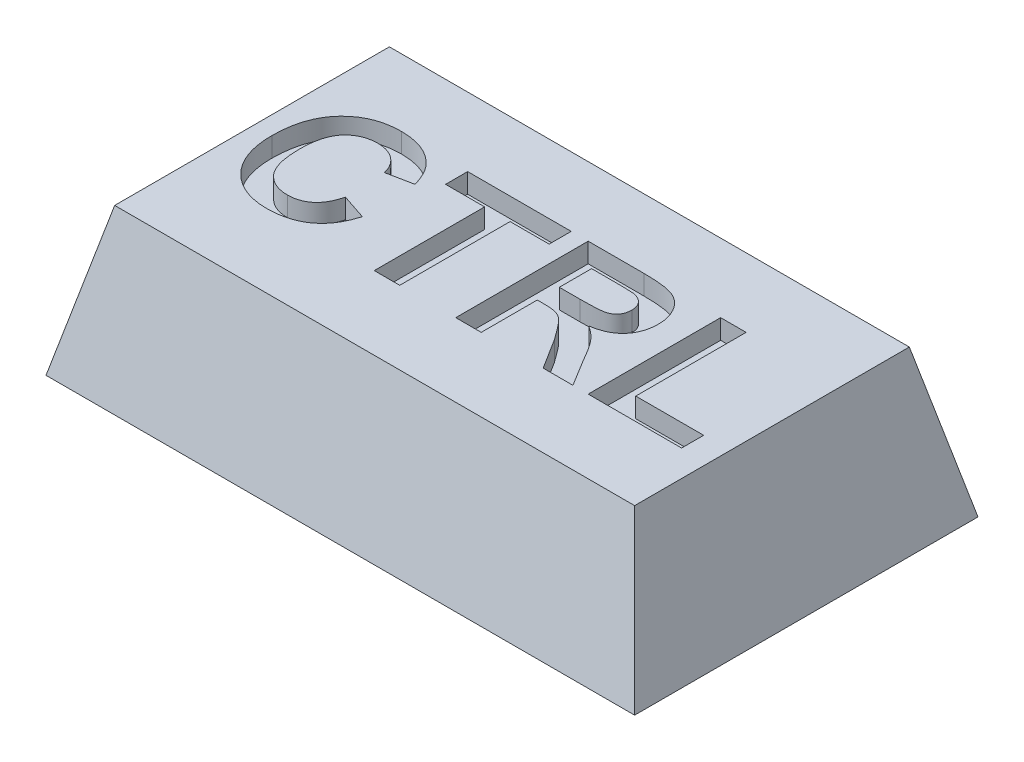
from build123d import *

# Parameters (mm, degrees)
SKETCH1_W               = 12
SKETCH1_H               = 7
BOSS_EXTRUDE1_DEPTH     = 3
CUT_EXTRUDE1_DEPTH      = 7
CUT_EXTRUDE2_DEPTH      = 15.212670404
CUT_EXTRUDE2_DEPTH_BACK = 15.212670404
SKETCH4_R               = 1.8
CUT_EXTRUDE3_DEPTH      = 0.8
CUT_EXTRUDE4_DEPTH      = 0.4


with BuildPart() as part:
    # Sketch1 → Boss-Extrude1 (new body)
    with BuildSketch(Plane(origin=(0, 0, 0), x_dir=(1, 0, 0), z_dir=(0, 1, 0))):
        with Locations((6, 3.5)):
            Rectangle(SKETCH1_W, SKETCH1_H)
    extrude(amount=BOSS_EXTRUDE1_DEPTH)

    # Sketch2 → Cut-Extrude1 (cut)
    with BuildSketch(Plane.XY):
        Polygon((0, 0), (0.7, 3), (0, 3), align=None)
        Polygon((12, 0), (11.3, 3), (12, 3), align=None)
    extrude(amount=-CUT_EXTRUDE1_DEPTH, mode=Mode.SUBTRACT)

    # Sketch3 → Cut-Extrude2 (cut, two sides: drawn at the far end of the back side and taken through both)
    with BuildSketch(Plane(origin=(0, 0, 0), x_dir=(0, 0, -1), z_dir=(1, 0, 0)).offset(-CUT_EXTRUDE2_DEPTH_BACK)):
        Polygon((0, 0), (0.7, 3), (0, 3), align=None)
        Polygon((7, 3), (6.3, 3), (7, 0), align=None)
    extrude(amount=CUT_EXTRUDE2_DEPTH + CUT_EXTRUDE2_DEPTH_BACK, mode=Mode.SUBTRACT)

    # Sketch4 → Cut-Extrude3 (cut)
    with BuildSketch(Plane.XZ):
        with Locations(Location((6, -3.5, 0), (0, 0, 270))):
            Circle(SKETCH4_R)
    extrude(amount=-CUT_EXTRUDE3_DEPTH, mode=Mode.SUBTRACT)

    # Sketch5 → Cut-Extrude4 (cut)
    # profile 1 of 4: a face of its own
    with BuildSketch(Plane(origin=(0, 3, 0), x_dir=(1, 0, 0), z_dir=(0, 1, 0))):
        with BuildLine():
            Line((2.904301517, 3.198955738), (3.423532286, 3.025878815))
            add(Edge.make_bspline(
                [(3.423532286, 3.025878815), (3.412979919, 2.991834161), (3.392315064, 2.92516402), (3.354370926, 2.829609877), (3.310982393, 2.741055496), (3.263709812, 2.658464408), (3.209613395, 2.583970206), (3.151721747, 2.515106434), (3.088313517, 2.453323494), (3.01970158, 2.398489455), (2.946546364, 2.349998522), (2.867998092, 2.309004749), (2.785228987, 2.273697875), (2.697399724, 2.245091862), (2.605093196, 2.222182789), (2.507876294, 2.207051221), (2.406203791, 2.196791518), (2.336780345, 2.195679117), (2.301236613, 2.195109584)],
                knots=[0, 0, 0, 0, 1.126640671, 2.206316847, 3.246446654, 4.24268115, 5.210795778, 6.153057602, 7.084219323, 8.004711971, 8.926421631, 9.854560063, 10.802134612, 11.768317461, 12.772025444, 13.805668576, 14.876536225, 16, 16, 16, 16], degree=3))
            add(Edge.make_bspline(
                [(2.301236613, 2.195109584), (2.25736514, 2.196016751), (2.171068639, 2.197801176), (2.044868181, 2.215763872), (1.924604851, 2.243789961), (1.810106604, 2.282591594), (1.702137701, 2.333984258), (1.599713096, 2.395854363), (1.503578201, 2.469457973), (1.41407027, 2.553554582), (1.332750152, 2.647502206), (1.262429286, 2.750793176), (1.202342539, 2.861972376), (1.153777331, 2.981569919), (1.115802616, 3.109463), (1.089201249, 3.245474787), (1.072555805, 3.389648123), (1.070659403, 3.488451991), (1.069686132, 3.539160065)],
                knots=[0, 0, 0, 0, 1.025049111, 2.016302254, 2.973197159, 3.90886983, 4.83646737, 5.763135642, 6.70136783, 7.661478232, 8.629732022, 9.600038443, 10.576877021, 11.5787097, 12.612181225, 13.690866959, 14.814907849, 16, 16, 16, 16], degree=3))
            add(Edge.make_bspline(
                [(1.069686132, 3.539160065), (1.070655016, 3.592571755), (1.072545132, 3.696768218), (1.089221758, 3.848260954), (1.115111229, 3.991034026), (1.153150126, 4.124202184), (1.201001661, 4.24870262), (1.26116136, 4.363299428), (1.330780777, 4.469520496), (1.411731825, 4.565418922), (1.501647677, 4.650563757), (1.598003634, 4.72585481), (1.701698609, 4.789018605), (1.812165161, 4.840670652), (1.929551445, 4.880641547), (2.053626477, 4.90942373), (2.184491772, 4.92617681), (2.273965024, 4.928526069), (2.319626036, 4.929724969)],
                knots=[0, 0, 0, 0, 1.212648312, 2.365655595, 3.457000981, 4.504219827, 5.506356588, 6.480637568, 7.437950897, 8.385265166, 9.323599949, 10.245787653, 11.157260172, 12.074946661, 13.00980897, 13.968233668, 14.963125779, 16, 16, 16, 16], degree=3))
            add(Edge.make_bspline(
                [(2.319626036, 4.929724969), (2.359503563, 4.928720159), (2.437688761, 4.926750094), (2.552183044, 4.913365405), (2.660691583, 4.88987617), (2.763800902, 4.858170926), (2.860924045, 4.816328437), (2.952235009, 4.765197347), (3.038047652, 4.705048191), (3.089751535, 4.658064577), (3.115779882, 4.634412469)],
                knots=[0, 0, 0, 0, 1.098510076, 2.153775193, 3.169777012, 4.153122333, 5.120892526, 6.076995459, 7.031936742, 8, 8, 8, 8], degree=3))
            add(Edge.make_bspline(
                [(3.115779882, 4.634412469), (3.130865571, 4.619362392), (3.1613913, 4.588908724), (3.202151715, 4.537494303), (3.240797653, 4.48214667), (3.276715725, 4.421921665), (3.308770718, 4.356364167), (3.338505148, 4.286480932), (3.365880522, 4.212002582), (3.381104378, 4.160170252), (3.388916902, 4.133571123)],
                knots=[0, 0, 0, 0, 0.885292881, 1.791380647, 2.722937556, 3.69093542, 4.703306561, 5.754477758, 6.847650944, 8, 8, 8, 8], degree=3))
            Line((3.388916902, 4.133571123), (2.869686132, 4.029724969))
            add(Edge.make_bspline(
                [(2.869686132, 4.029724969), (2.865272884, 4.046755768), (2.856579944, 4.080301975), (2.838990961, 4.128506031), (2.81881501, 4.174247375), (2.793808768, 4.216405643), (2.767245672, 4.256856335), (2.735796465, 4.293803317), (2.701469605, 4.328214887), (2.664017805, 4.359733936), (2.623887546, 4.387723575), (2.581851476, 4.412884517), (2.537145573, 4.433423708), (2.490364536, 4.450039865), (2.441694689, 4.463971261), (2.390702722, 4.472577333), (2.337826596, 4.479184016), (2.301800218, 4.479542008), (2.283388056, 4.479724969)],
                knots=[0, 0, 0, 0, 1.051226935, 2.070641259, 3.064374968, 4.034983734, 4.997599858, 5.953980297, 6.92954377, 7.901109626, 8.875958313, 9.851998019, 10.826131395, 11.811470594, 12.818270757, 13.847890818, 14.900111925, 16, 16, 16, 16], degree=3))
            add(Edge.make_bspline(
                [(2.283388056, 4.479724969), (2.258102365, 4.479214313), (2.208752263, 4.478217666), (2.136619529, 4.467105725), (2.067868834, 4.451597862), (2.002777447, 4.427917435), (1.941748463, 4.397630364), (1.884088282, 4.360813044), (1.830113375, 4.31762317), (1.779805498, 4.267549086), (1.734661017, 4.209685427), (1.694972575, 4.143912725), (1.662047454, 4.069484249), (1.635317492, 3.987130374), (1.614277967, 3.896655264), (1.599254089, 3.797942878), (1.590945433, 3.690925687), (1.58960767, 3.616878354), (1.588916902, 3.578643238)],
                knots=[0, 0, 0, 0, 0.938194206, 1.831074359, 2.704771284, 3.551924377, 4.396294915, 5.230222094, 6.087631332, 6.958733431, 7.860107878, 8.806247581, 9.804197948, 10.875520245, 12.017191412, 13.250061517, 14.580040491, 16, 16, 16, 16], degree=3))
            add(Edge.make_bspline(
                [(1.588916902, 3.578643238), (1.589600868, 3.53806521), (1.590918766, 3.4598776), (1.599225659, 3.347099204), (1.614345607, 3.243372916), (1.635105518, 3.148514656), (1.661970182, 3.062582527), (1.694839623, 2.985725233), (1.733915116, 2.917852766), (1.779135866, 2.85901032), (1.829358618, 2.80846484), (1.883223124, 2.765007236), (1.940411596, 2.727851155), (2.001268168, 2.697281528), (2.066024305, 2.674155945), (2.134147808, 2.657384867), (2.205888634, 2.646723226), (2.255044552, 2.645655003), (2.280142863, 2.645109584)],
                knots=[0, 0, 0, 0, 1.475208372, 2.842499301, 4.107722225, 5.282836115, 6.369007568, 7.375918121, 8.315702116, 9.208439171, 10.065831443, 10.90006451, 11.71996243, 12.54067204, 13.369972975, 14.214060185, 15.088124569, 16, 16, 16, 16], degree=3))
            add(Edge.make_bspline(
                [(2.280142863, 2.645109584), (2.298724738, 2.645573173), (2.335263235, 2.64648475), (2.38926995, 2.652270464), (2.441105383, 2.663311666), (2.49102325, 2.677911657), (2.5392175, 2.696230338), (2.584953012, 2.719729522), (2.629129612, 2.746738345), (2.670830671, 2.778390615), (2.710614588, 2.813926332), (2.74689988, 2.854996764), (2.780557501, 2.900615082), (2.811160453, 2.951086154), (2.839731278, 3.005977966), (2.864039482, 3.066145762), (2.886684752, 3.130617201), (2.898326696, 3.175778353), (2.904301517, 3.198955738)],
                knots=[0, 0, 0, 0, 0.980177776, 1.927374078, 2.859849964, 3.771585772, 4.668674471, 5.574490016, 6.479656464, 7.396337719, 8.332153134, 9.288470092, 10.28125149, 11.318486971, 12.398724812, 13.541284404, 14.738150009, 16, 16, 16, 16], degree=3))
        make_face()
    # profile 2 of 4: a face of its own
    with BuildSketch(Plane(origin=(0, 3, 0), x_dir=(1, 0, 0), z_dir=(0, 1, 0))):
        Polygon((4.496609209, 2.195109584), (4.496609209, 4.445109584), (3.700455363, 4.445109584), (3.700455363, 4.895109584), (5.811993825, 4.895109584), (5.811993825, 4.445109584), (5.015839979, 4.445109584), (5.015839979, 2.195109584), align=None)
    # profile 3 of 4: a face of its own
    with BuildSketch(Plane(origin=(0, 3, 0), x_dir=(1, 0, 0), z_dir=(0, 1, 0))):
        with BuildLine():
            Line((6.158147671, 2.195109584), (6.158147671, 4.895109584))
            Line((6.158147671, 4.895109584), (7.291260652, 4.895109584))
            add(Edge.make_bspline(
                [(7.291260652, 4.895109584), (7.325697075, 4.894897353), (7.392062366, 4.894488346), (7.488039523, 4.891505779), (7.576552007, 4.885257129), (7.657992458, 4.878180481), (7.731969713, 4.867884414), (7.798776265, 4.855549828), (7.858299638, 4.841255743), (7.911408316, 4.824136258), (7.959832642, 4.804542413), (8.004942277, 4.781220224), (8.047233215, 4.753895414), (8.087355005, 4.723509794), (8.125477544, 4.690016674), (8.160555716, 4.652529661), (8.193200675, 4.611606949), (8.223386082, 4.567589017), (8.249977535, 4.520670231), (8.274275142, 4.472357399), (8.294054311, 4.422136399), (8.310391725, 4.37024381), (8.323442303, 4.316792297), (8.332500506, 4.261645967), (8.338155445, 4.204904636), (8.338660263, 4.166577513), (8.338916902, 4.147092757)],
                knots=[0, 0, 0, 0, 1.675828044, 3.229627355, 4.67171229, 5.993455049, 7.206927059, 8.304770529, 9.29850117, 10.183580433, 11.017754134, 11.837875825, 12.650738409, 13.464925643, 14.285328857, 15.117007378, 15.959673368, 16.830859064, 17.711229498, 18.58228265, 19.460420693, 20.334473227, 21.228207035, 22.135446768, 23.052097822, 24, 24, 24, 24], degree=3))
            add(Edge.make_bspline(
                [(8.338916902, 4.147092757), (8.338440875, 4.122547419), (8.337510587, 4.074579062), (8.328949584, 4.004272379), (8.316234309, 3.937099363), (8.298108782, 3.87296695), (8.273186552, 3.81262943), (8.244254889, 3.755241559), (8.20974902, 3.700997999), (8.169903376, 3.650436492), (8.124753629, 3.603512279), (8.074101914, 3.561191027), (8.018309869, 3.523307332), (7.957039987, 3.490079656), (7.890718892, 3.461673593), (7.819058996, 3.437773597), (7.742384701, 3.418321664), (7.689050104, 3.409168947), (7.66175344, 3.404484584)],
                knots=[0, 0, 0, 0, 1.05911256, 2.069797862, 3.05271628, 4.008392045, 4.940519534, 5.866323021, 6.779546087, 7.71056835, 8.640711998, 9.585328432, 10.554502533, 11.547017206, 12.589327225, 13.664782803, 14.804835066, 16, 16, 16, 16], degree=3))
            add(Edge.make_bspline(
                [(7.66175344, 3.404484584), (7.68815238, 3.387000318), (7.739818702, 3.352781227), (7.811302778, 3.296421955), (7.875478517, 3.237268541), (7.924069149, 3.184665645), (7.961406042, 3.138407048), (7.99146862, 3.097948834), (8.02389593, 3.051387298), (8.058369931, 2.998697212), (8.095909761, 2.940344759), (8.135119246, 2.875436763), (8.176818902, 2.804606349), (8.204855311, 2.755127718), (8.219385652, 2.729484584)],
                knots=[0, 0, 0, 0, 1.285445069, 2.515791127, 3.691898215, 4.826622834, 5.420063933, 6.105349801, 6.873086501, 7.723915395, 8.66222816, 9.690593598, 10.803111229, 12, 12, 12, 12], degree=3))
            Line((8.219385652, 2.729484584), (8.546609209, 2.195109584))
            Line((8.546609209, 2.195109584), (7.939758248, 2.195109584))
            Line((7.939758248, 2.195109584), (7.555743825, 2.807910065))
            add(Edge.make_bspline(
                [(7.555743825, 2.807910065), (7.538107593, 2.832452282), (7.504436401, 2.87930842), (7.455829955, 2.945892512), (7.411359371, 3.005164314), (7.372208159, 3.057982342), (7.336395285, 3.102849081), (7.30500817, 3.140546403), (7.278686129, 3.171883239), (7.248902674, 3.202955063), (7.214252786, 3.234888244), (7.171358993, 3.265849281), (7.127311047, 3.290531092), (7.080117191, 3.309363895), (7.025538923, 3.322495376), (6.959927201, 3.330861799), (6.881219039, 3.337034451), (6.824328807, 3.337283199), (6.793664498, 3.337417277)],
                knots=[0, 0, 0, 0, 1.465447777, 2.797841088, 3.997266218, 5.05856206, 5.985598736, 6.780315439, 7.437430484, 7.969193402, 8.866571936, 9.718200644, 10.52825214, 11.309096006, 12.174169268, 13.242355782, 14.513606761, 16, 16, 16, 16], degree=3))
            Line((6.793664498, 3.337417277), (6.67737844, 3.337417277))
            Line((6.67737844, 3.337417277), (6.67737844, 2.195109584))
            Line((6.67737844, 2.195109584), (6.158147671, 2.195109584))
        make_face()
        with BuildLine():
            Line((6.67737844, 3.787417277), (7.095467382, 3.787417277))
            add(Edge.make_bspline(
                [(7.095467382, 3.787417277), (7.127740575, 3.78748644), (7.189226461, 3.787618208), (7.276660614, 3.789526814), (7.354768753, 3.791146759), (7.423083461, 3.795216938), (7.481910383, 3.79925087), (7.531013534, 3.804493517), (7.570806622, 3.810690158), (7.610553229, 3.820324306), (7.651267259, 3.837109908), (7.694660712, 3.861017546), (7.731748022, 3.892032236), (7.763874199, 3.927888353), (7.788381971, 3.970040481), (7.807577354, 4.016610694), (7.817309819, 4.068633822), (7.818877431, 4.104692625), (7.819686132, 4.12329468)],
                knots=[0, 0, 0, 0, 1.697953026, 3.23488743, 4.60134403, 5.807846676, 6.835100678, 7.703488618, 8.405232423, 8.952775585, 9.851109663, 10.713519226, 11.549115941, 12.382556273, 13.233359028, 14.101746968, 15.020727134, 16, 16, 16, 16], degree=3))
            add(Edge.make_bspline(
                [(7.819686132, 4.12329468), (7.818766387, 4.144104925), (7.816991885, 4.184254936), (7.802997916, 4.241388785), (7.778572012, 4.291858673), (7.745025975, 4.33574793), (7.702914211, 4.372808651), (7.652754443, 4.402226797), (7.594919322, 4.424136211), (7.553204898, 4.432227316), (7.531404882, 4.436455738)],
                knots=[0, 0, 0, 0, 1.062977961, 2.050844577, 2.982300261, 3.90936959, 4.856017476, 5.831122378, 6.86654153, 8, 8, 8, 8], degree=3))
            add(Edge.make_bspline(
                [(7.531404882, 4.436455738), (7.524198865, 4.437247525), (7.507119091, 4.439124225), (7.476958235, 4.440329547), (7.43839371, 4.442182258), (7.390958733, 4.44293942), (7.335077084, 4.444266658), (7.270526554, 4.444510372), (7.197512223, 4.445289022), (7.145948464, 4.445171586), (7.118724594, 4.445109584)],
                knots=[0, 0, 0, 0, 0.42127143, 0.998501726, 1.753681744, 2.66564073, 3.755712164, 5.002818897, 6.417592707, 8, 8, 8, 8], degree=3))
            Line((7.118724594, 4.445109584), (6.67737844, 4.445109584))
            Line((6.67737844, 4.445109584), (6.67737844, 3.787417277))
        make_face(mode=Mode.SUBTRACT)
    # profile 4 of 4: a face of its own
    with BuildSketch(Plane(origin=(0, 3, 0), x_dir=(1, 0, 0), z_dir=(0, 1, 0))):
        Polygon((8.858147671, 2.195109584), (8.858147671, 4.895109584), (9.37737844, 4.895109584), (9.37737844, 2.645109584), (10.761993825, 2.645109584), (10.761993825, 2.195109584), align=None)
    extrude(amount=-CUT_EXTRUDE4_DEPTH, mode=Mode.SUBTRACT)


solid = part.part
